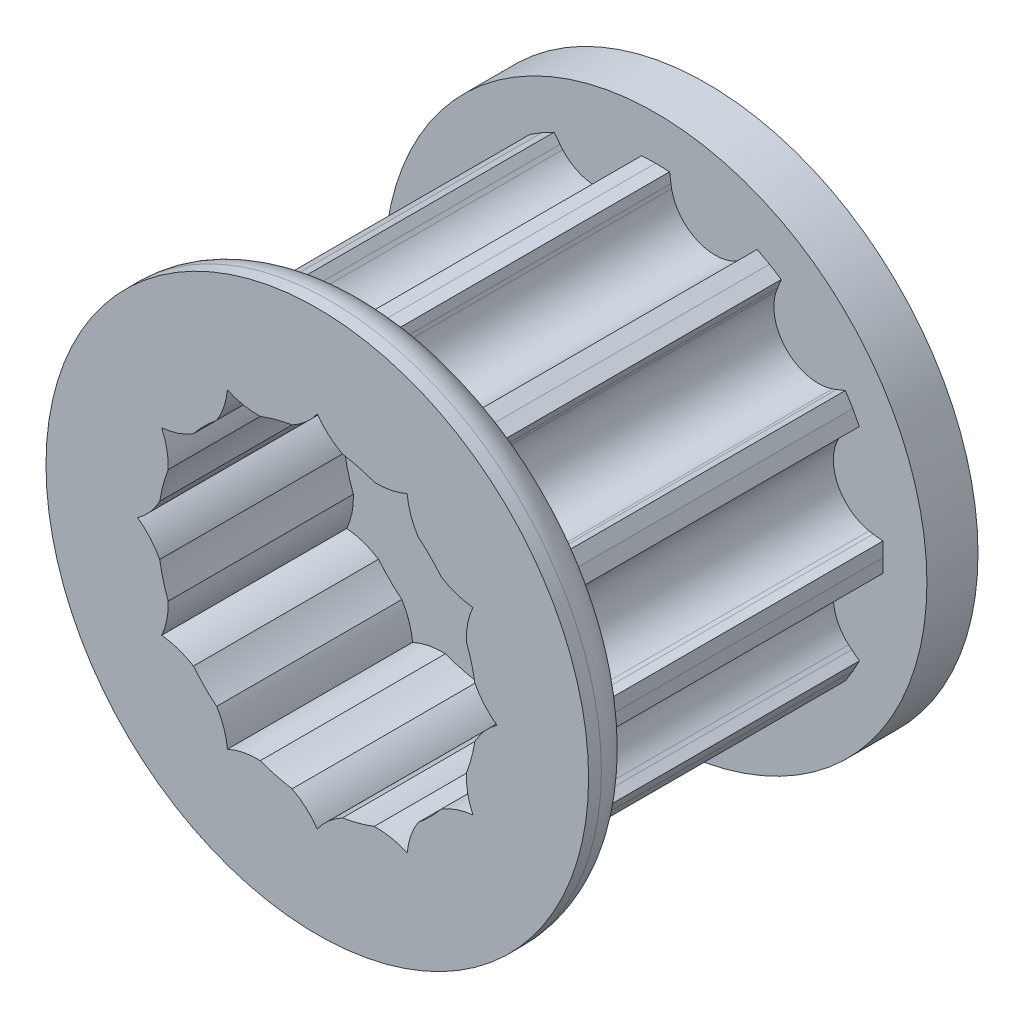
from build123d import *

# Parameters (mm, degrees)
BOSS_EXTRU_1_DEPTH           = 2.25
R_P_TITION_CIRCULAIRE2_COUNT = 12
BOSS_EXTRUDE1_START          = 2.25
SKETCH3_R                    = 4.25
BOSS_EXTRUDE1_DEPTH          = 0.8
ESQUISSE2_R                  = 2.5
ENL_V_MAT_EXTRU_1_DEPTH      = 2.9
ESQUISSE2_3_R                = 1.1
CUT_EXTRUDE1_DEPTH           = 10
FILLET1_R                    = 0.6
CUT_EXTRUDE2_DEPTH           = 2.9


with BuildPart() as part:
    # Esquisse1 → Boss.-Extru.1 (new, symmetric)
    with BuildSketch(Plane.XY):
        with BuildLine():
            Line((-0.752465142, 2.808238143), (0, 0))
            Line((0, 0), (0.752465142, 2.808238143))
            ThreePointArc((0.752465142, 2.808238143), (0.424894473, 3.004667559), (0.250587868, 3.344526744))
            ThreePointArc((0.250587868, 3.344526744), (0.24466657, 3.376862532), (0.239680084, 3.409355606))
            Line((0.239680084, 3.409355606), (0.218920092, 3.558991904))
            Line((0.218920092, 3.558991904), (0, 3.565718634))
            Line((0, 3.565718634), (-0.218920092, 3.558991904))
            Line((-0.218920092, 3.558991904), (-0.239680084, 3.409355606))
            ThreePointArc((-0.239680084, 3.409355606), (-0.24466657, 3.376862532), (-0.250587868, 3.344526744))
            ThreePointArc((-0.250587868, 3.344526744), (-0.424894473, 3.004667559), (-0.752465142, 2.808238143))
        make_face()
    boss_extru_1 = extrude(amount=BOSS_EXTRU_1_DEPTH, both=True)

    # Répétition circulaire2: Boss.-Extru.1 ×12 about axis
    r_p_tition_circulaire2_axis = Axis((0, 0, 0), (0, 0, 1))
    for i in range(1, R_P_TITION_CIRCULAIRE2_COUNT):
        add(boss_extru_1.rotate(r_p_tition_circulaire2_axis, i * 360 / R_P_TITION_CIRCULAIRE2_COUNT))

    # Sketch3 → Boss-Extrude1 (add)
    with BuildSketch(Plane.XY.offset(BOSS_EXTRUDE1_START)):
        with Locations(Location((0, 0, 0), (0, 0, 180))):
            Circle(SKETCH3_R)
    boss_extrude1 = extrude(amount=BOSS_EXTRUDE1_DEPTH)

    # Mirror2: Boss-Extrude1 across plane
    add(boss_extrude1.mirror(Plane.XY))

    # Esquisse2 → Enlèv. mat.-Extru.1 (cut)
    with BuildSketch(Plane.XY.offset(3.05)):
        Circle(ESQUISSE2_R)
    extrude(amount=-ENL_V_MAT_EXTRU_1_DEPTH, mode=Mode.SUBTRACT)

    # Esquisse2<3> → Cut-Extrude1 (cut)
    with BuildSketch(Plane.XY.offset(3.05)):
        Circle(ESQUISSE2_3_R)
    extrude(amount=-CUT_EXTRUDE1_DEPTH, mode=Mode.SUBTRACT)

    # Fillet1
    fillet1_edges = [part.edges().sort_by_distance(p)[0] for p in [
        (4.25, 0, 2.25),
    ]]
    fillet(fillet1_edges, radius=FILLET1_R)

    # Sketch4 → Cut-Extrude2 (cut)
    with BuildSketch(Plane.XY.offset(3.05)):
        with BuildLine():
            ThreePointArc((-2.43778105, -1.407453545), (-2.373571521, -0.635996572), (-2.814907091, 0))
            ThreePointArc((-2.814907091, 0), (-2.373571521, 0.635996572), (-2.43778105, 1.407453545))
            ThreePointArc((-2.43778105, 1.407453545), (-1.737574949, 1.737574949), (-1.407453545, 2.43778105))
            ThreePointArc((-1.407453545, 2.43778105), (-0.635996572, 2.373571521), (0, 2.814907091))
            ThreePointArc((0, 2.814907091), (0.635996572, 2.373571521), (1.407453545, 2.43778105))
            ThreePointArc((1.407453545, 2.43778105), (1.737574949, 1.737574949), (2.43778105, 1.407453545))
            ThreePointArc((2.43778105, 1.407453545), (2.373571521, 0.635996572), (2.814907091, 0))
            ThreePointArc((2.814907091, 0), (2.373571521, -0.635996572), (2.43778105, -1.407453545))
            ThreePointArc((2.43778105, -1.407453545), (1.737574949, -1.737574949), (1.407453545, -2.43778105))
            ThreePointArc((1.407453545, -2.43778105), (0.635996572, -2.373571521), (0, -2.814907091))
            ThreePointArc((0, -2.814907091), (-0.635996572, -2.373571521), (-1.407453545, -2.43778105))
            ThreePointArc((-1.407453545, -2.43778105), (-1.737574949, -1.737574949), (-2.43778105, -1.407453545))
        make_face()
    extrude(amount=-CUT_EXTRUDE2_DEPTH, mode=Mode.SUBTRACT)


solid = part.part
